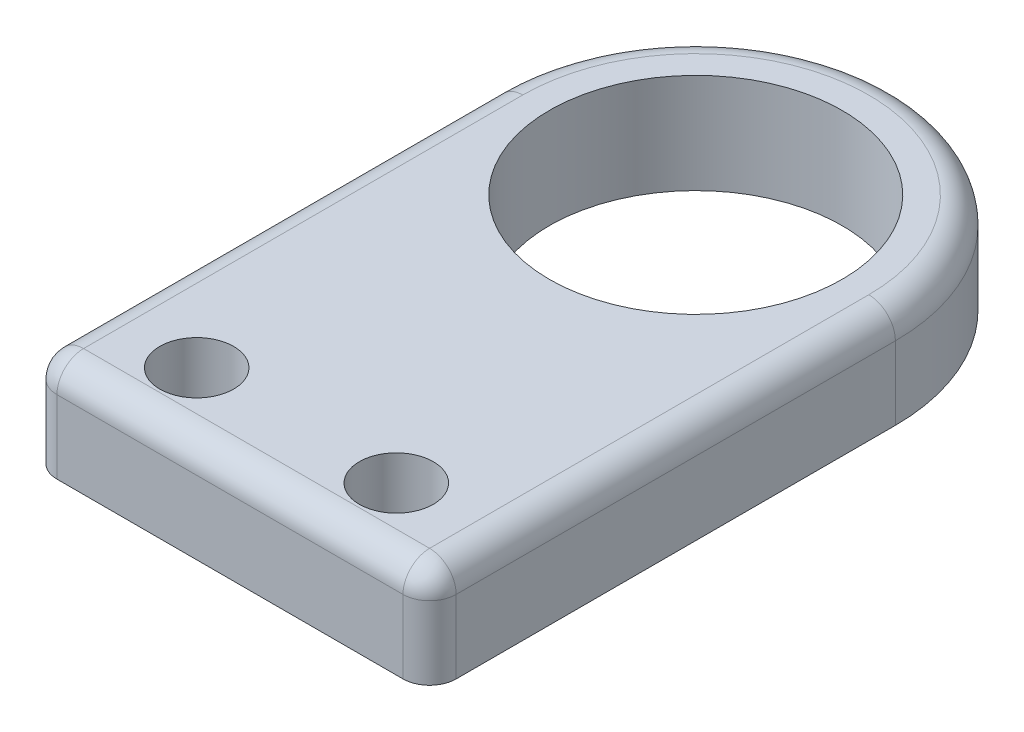
from build123d import *

# Parameters (mm, degrees)
SKETCH1_R                                           = 11
BOSS_EXTRUDE1_DEPTH                                 = 7.5
CBORE_FOR_2_BINDING_HEAD_MACHINE_SCREW1_D           = 2.4384
CBORE_FOR_2_BINDING_HEAD_MACHINE_SCREW1_DEPTH       = 10
CBORE_FOR_2_BINDING_HEAD_MACHINE_SCREW1_CBORE_D     = 5.55752
CBORE_FOR_2_BINDING_HEAD_MACHINE_SCREW1_CBORE_DEPTH = 4.999999906
CBORE_FOR_2_BINDING_HEAD_MACHINE_SCREW1_TIP         = 0.732569267
FILLET1_R                                           = 2


with BuildPart() as part:
    # Sketch1 → Boss-Extrude1 (new body)
    with BuildSketch(Plane(origin=(0, 0, 0), x_dir=(1, 0, 0), z_dir=(0, 1, 0))):
        with BuildLine():
            Line((-15, 0), (15, 0))
            Line((15, 0), (15, 35))
            ThreePointArc((15, 35), (0, 50), (-15, 35))
            Line((-15, 35), (-15, 0))
        make_face()
        with Locations(Location((0, 35, 0), (0, 0, 270))):
            Circle(SKETCH1_R, mode=Mode.SUBTRACT)
    extrude(amount=BOSS_EXTRUDE1_DEPTH)

    # CBORE for #2 Binding Head Machine Screw1
    with Locations(Plane(origin=(0, 7.5, 0), x_dir=(1, 0, 0), z_dir=(0, 1, 0))):
        with Locations((-7.5, 5), (7.5, 5)):
            CounterBoreHole(CBORE_FOR_2_BINDING_HEAD_MACHINE_SCREW1_D / 2, CBORE_FOR_2_BINDING_HEAD_MACHINE_SCREW1_CBORE_D / 2, CBORE_FOR_2_BINDING_HEAD_MACHINE_SCREW1_CBORE_DEPTH, depth=CBORE_FOR_2_BINDING_HEAD_MACHINE_SCREW1_DEPTH)
            with Locations((0, 0, -(CBORE_FOR_2_BINDING_HEAD_MACHINE_SCREW1_DEPTH + CBORE_FOR_2_BINDING_HEAD_MACHINE_SCREW1_TIP / 2))):  # 118° drill point
                Cone(0, CBORE_FOR_2_BINDING_HEAD_MACHINE_SCREW1_D / 2, CBORE_FOR_2_BINDING_HEAD_MACHINE_SCREW1_TIP, mode=Mode.SUBTRACT)

    # Fillet1
    fillet1_edges = [part.edges().sort_by_distance(p)[0] for p in [
        (15, 7.5, -17.5),
        (0, 7.5, -50),
        (-15, 7.5, -17.5),
        (15, 3.75, 0),
        (-15, 3.75, 0),
        (0, 7.5, 0),
    ]]
    fillet(fillet1_edges, radius=FILLET1_R)


solid = part.part
